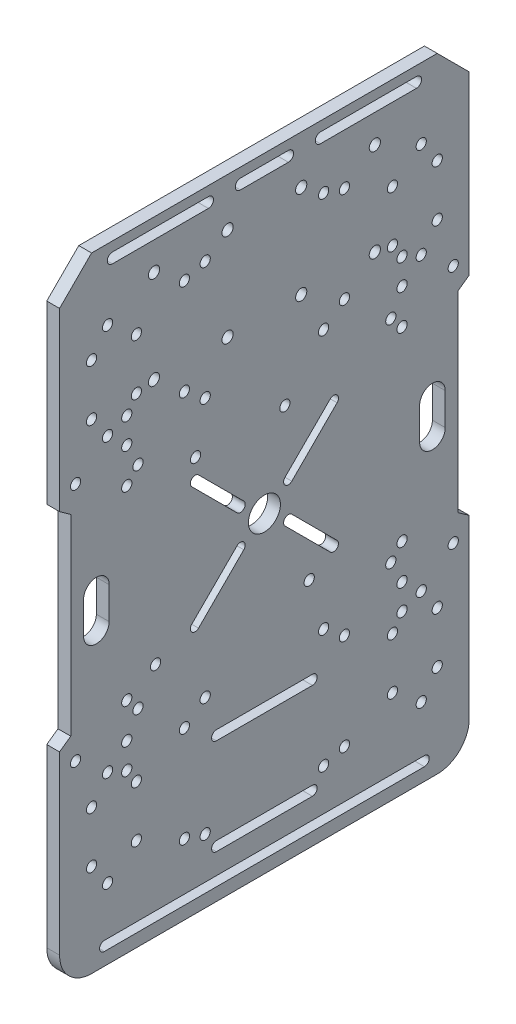
from build123d import *

# Parameters (mm, degrees)
SKETCH_2_W          = 128
SKETCH_2_H          = 195
EXTRUDE_1_DEPTH     = 4
SKETCH_3_R          = 1.6
CUT_EXTRUDE_1_DEPTH = 4
SKETCH_4_R          = 1.6
CUT_EXTRUDE_2_DEPTH = 4
SKETCH_6_R          = 1.75
SKETCH_6_R_2        = 5
SKETCH_6_R_3        = 1.6
CUT_EXTRUDE_4_DEPTH = 10
SKETCH_7_R          = 1.6
CUT_EXTRUDE_5_DEPTH = 10
CHAMFER_1_SIZE      = 10
FILLET_1_R          = 10
CUT_EXTRUDE_6_DEPTH = 10


with BuildPart() as part:
    # 草图2 → 凸台-拉伸1 (new body)
    with BuildSketch(Plane(origin=(0, 0, 0), x_dir=(0, 0, -1), z_dir=(1, 0, 0))):
        with Locations((64, 97.5)):
            Rectangle(SKETCH_2_W, SKETCH_2_H)
    extrude(amount=EXTRUDE_1_DEPTH)

    # 草图3 → 切除-拉伸1 (cut)
    with BuildSketch(Plane(origin=(4, 0, 0), x_dir=(0, 0, -1), z_dir=(1, 0, 0))):
        with Locations((24, 166)):
            Circle(SKETCH_3_R)
        with Locations((24, 150)):
            Circle(SKETCH_3_R)
        with Locations((10, 166)):
            Circle(SKETCH_3_R)
        with Locations((10, 150)):
            Circle(SKETCH_3_R)
        with Locations((24, 45)):
            Circle(SKETCH_3_R)
        with Locations((24, 29)):
            Circle(SKETCH_3_R)
        with Locations((10, 45)):
            Circle(SKETCH_3_R)
        with Locations((10, 29)):
            Circle(SKETCH_3_R)
        with Locations(Location((118, 29, 0), (0, 0, 180))):
            Circle(SKETCH_3_R)
        with Locations(Location((118, 45, 0), (0, 0, 180))):
            Circle(SKETCH_3_R)
        with Locations(Location((104, 45, 0), (0, 0, 180))):
            Circle(SKETCH_3_R)
        with Locations(Location((104, 29, 0), (0, 0, 180))):
            Circle(SKETCH_3_R)
        with Locations(Location((104, 150, 0), (0, 0, 180))):
            Circle(SKETCH_3_R)
        with Locations(Location((118, 150, 0), (0, 0, 180))):
            Circle(SKETCH_3_R)
        with Locations(Location((118, 166, 0), (0, 0, 180))):
            Circle(SKETCH_3_R)
        with Locations(Location((104, 166, 0), (0, 0, 180))):
            Circle(SKETCH_3_R)
        with Locations((15, 173)):
            Circle(SKETCH_3_R)
        with Locations((39, 173)):
            Circle(SKETCH_3_R)
        with Locations((39, 143)):
            Circle(SKETCH_3_R)
        with Locations((15, 143)):
            Circle(SKETCH_3_R)
        with Locations(Location((89, 143, 0), (0, 0, 180))):
            Circle(SKETCH_3_R)
        with Locations(Location((113, 143, 0), (0, 0, 180))):
            Circle(SKETCH_3_R)
        with Locations(Location((113, 173, 0), (0, 0, 180))):
            Circle(SKETCH_3_R)
        with Locations(Location((89, 173, 0), (0, 0, 180))):
            Circle(SKETCH_3_R)
        with Locations((113, 52)):
            Circle(SKETCH_3_R)
        with Locations((89, 52)):
            Circle(SKETCH_3_R)
        with Locations((89, 22)):
            Circle(SKETCH_3_R)
        with Locations((113, 22)):
            Circle(SKETCH_3_R)
        with Locations(Location((39, 52, 0), (0, 0, 180))):
            Circle(SKETCH_3_R)
        with Locations(Location((15, 52, 0), (0, 0, 180))):
            Circle(SKETCH_3_R)
        with Locations(Location((39, 22, 0), (0, 0, 180))):
            Circle(SKETCH_3_R)
        with Locations(Location((15, 22, 0), (0, 0, 180))):
            Circle(SKETCH_3_R)
    extrude(amount=-CUT_EXTRUDE_1_DEPTH, mode=Mode.SUBTRACT)

    # 草图4 → 切除-拉伸2 (cut)
    with BuildSketch(Plane(origin=(4, 0, 0), x_dir=(0, 0, -1), z_dir=(1, 0, 0))):
        with Locations((21, 57.5)):
            Circle(SKETCH_4_R)
        with Locations((21, 49.5)):
            Circle(SKETCH_4_R)
        with Locations(Location((107, 49.5, 0), (0, 0, 180))):
            Circle(SKETCH_4_R)
        with Locations(Location((107, 57.5, 0), (0, 0, 180))):
            Circle(SKETCH_4_R)
        with Locations((21, 145.5)):
            Circle(SKETCH_4_R)
        with Locations((21, 137.5)):
            Circle(SKETCH_4_R)
        with Locations(Location((107, 137.5, 0), (0, 0, 180))):
            Circle(SKETCH_4_R)
        with Locations(Location((107, 145.5, 0), (0, 0, 180))):
            Circle(SKETCH_4_R)
    extrude(amount=-CUT_EXTRUDE_2_DEPTH, mode=Mode.SUBTRACT)

    # 草图6 → 切除-拉伸4 (cut)
    with BuildSketch(Plane(origin=(4, 0, 0), x_dir=(0, 0, -1), z_dir=(1, 0, 0))):
        with Locations((52.5, 180)):
            Circle(SKETCH_6_R)
        with Locations((52.5, 151)):
            Circle(SKETCH_6_R)
        with Locations((29.5, 151)):
            Circle(SKETCH_6_R)
        with Locations((29.5, 180)):
            Circle(SKETCH_6_R)
        with Locations((98.5, 180)):
            Circle(SKETCH_6_R)
        with Locations((98.5, 151)):
            Circle(SKETCH_6_R)
        with Locations((75.5, 151)):
            Circle(SKETCH_6_R)
        with Locations((75.5, 180)):
            Circle(SKETCH_6_R)
        with Locations((64, 97.5)):
            Circle(SKETCH_6_R_2)
        with Locations((45.5, 175)):
            Circle(SKETCH_6_R_3)
        with Locations((82.5, 175)):
            Circle(SKETCH_6_R_3)
        with Locations((82.5, 138)):
            Circle(SKETCH_6_R_3)
        with Locations((45.5, 138)):
            Circle(SKETCH_6_R_3)
        with Locations((82.5, 20)):
            Circle(SKETCH_6_R_3)
        with Locations((45.5, 20)):
            Circle(SKETCH_6_R_3)
        with Locations((45.5, 57)):
            Circle(SKETCH_6_R_3)
        with Locations((82.5, 57)):
            Circle(SKETCH_6_R_3)
        with Locations((78, 72.5)):
            Circle(SKETCH_6_R_3)
        with Locations((42.5, 123.5)):
            Circle(SKETCH_6_R_3)
        with Locations((30, 73.7)):
            Circle(SKETCH_6_R_3)
        with Locations((70.4, 123.5)):
            Circle(SKETCH_6_R_3)
        with Locations((21, 126.5)):
            Circle(SKETCH_6_R_3)
        with Locations((107, 126.5)):
            Circle(SKETCH_6_R_3)
        with Locations((107, 68.5)):
            Circle(SKETCH_6_R_3)
        with Locations((21, 68.5)):
            Circle(SKETCH_6_R_3)
        with Locations((24.5, 64.5)):
            Circle(SKETCH_6_R_3)
        with Locations((103.5, 64.5)):
            Circle(SKETCH_6_R_3)
        with Locations((103.5, 130.5)):
            Circle(SKETCH_6_R_3)
        with Locations((24.5, 130.5)):
            Circle(SKETCH_6_R_3)
        with BuildLine():
            Line((79, 13.5), (49, 13.5))
            ThreePointArc((49, 13.5), (47.5, 15), (49, 16.5))
            Line((49, 16.5), (79, 16.5))
            ThreePointArc((79, 16.5), (80.5, 15), (79, 13.5))
        make_face()
        with BuildLine():
            Line((79, 43.5), (49, 43.5))
            ThreePointArc((49, 43.5), (47.5, 45), (49, 46.5))
            Line((49, 46.5), (79, 46.5))
            ThreePointArc((79, 46.5), (80.5, 45), (79, 43.5))
        make_face()
        with BuildLine():
            Line((16.5, 192), (46.5, 192))
            ThreePointArc((46.5, 192), (48.1, 190.4), (46.5, 188.8))
            Line((46.5, 188.8), (16.5, 188.8))
            ThreePointArc((16.5, 188.8), (14.9, 190.4), (16.5, 192))
        make_face()
        with BuildLine():
            Line((84.581475448, 76.766874121), (70.439339824, 90.909009744))
            ThreePointArc((70.439339824, 90.909009744), (70.439339828, 93.030330084), (72.560660168, 93.030330088))
            Line((72.560660168, 93.030330088), (86.702795791, 78.888194464))
            ThreePointArc((86.702795791, 78.888194464), (86.702795791, 76.766874121), (84.581475448, 76.766874121))
        make_face()
        with BuildLine():
            Line((43.418524552, 76.766874121), (57.560660176, 90.909009744))
            ThreePointArc((57.560660176, 90.909009744), (57.560660172, 93.030330084), (55.439339832, 93.030330088))
            Line((55.439339832, 93.030330088), (41.297204209, 78.888194464))
            ThreePointArc((41.297204209, 78.888194464), (41.297204209, 76.766874121), (43.418524552, 76.766874121))
        make_face()
        with BuildLine():
            Line((43.418524552, 118.233125879), (57.560660176, 104.090990256))
            ThreePointArc((57.560660176, 104.090990256), (57.560660172, 101.969669916), (55.439339832, 101.969669912))
            Line((55.439339832, 101.969669912), (41.297204209, 116.111805536))
            ThreePointArc((41.297204209, 116.111805536), (41.297204209, 118.233125879), (43.418524552, 118.233125879))
        make_face()
        with BuildLine():
            Line((84.581475448, 118.233125879), (70.439339824, 104.090990256))
            ThreePointArc((70.439339824, 104.090990256), (70.439339828, 101.969669916), (72.560660168, 101.969669912))
            Line((72.560660168, 101.969669912), (86.702795791, 116.111805536))
            ThreePointArc((86.702795791, 116.111805536), (86.702795791, 118.233125879), (84.581475448, 118.233125879))
        make_face()
        with BuildLine():
            Line((15.5, 102.5), (15.5, 92.5))
            ThreePointArc((15.5, 92.5), (11.5, 88.5), (7.5, 92.5))
            Line((7.5, 92.5), (7.5, 102.5))
            ThreePointArc((7.5, 102.5), (11.5, 106.5), (15.5, 102.5))
        make_face()
        with BuildLine():
            Line((112.5, 102.5), (112.5, 92.5))
            ThreePointArc((112.5, 92.5), (116.5, 88.5), (120.5, 92.5))
            Line((120.5, 92.5), (120.5, 102.5))
            ThreePointArc((120.5, 102.5), (116.5, 106.5), (112.5, 102.5))
        make_face()
        with BuildLine():
            Line((56.5, 192), (71.5, 192))
            ThreePointArc((71.5, 192), (73.1, 190.4), (71.5, 188.8))
            Line((71.5, 188.8), (56.5, 188.8))
            ThreePointArc((56.5, 188.8), (54.9, 190.4), (56.5, 192))
        make_face()
        with BuildLine():
            Line((111.5, 192), (81.5, 192))
            ThreePointArc((81.5, 192), (79.9, 190.4), (81.5, 188.8))
            Line((81.5, 188.8), (111.5, 188.8))
            ThreePointArc((111.5, 188.8), (113.1, 190.4), (111.5, 192))
        make_face()
        with BuildLine():
            Line((14, 7), (114, 7))
            ThreePointArc((114, 7), (115.5, 5.5), (114, 4))
            Line((114, 4), (14, 4))
            ThreePointArc((14, 4), (12.5, 5.5), (14, 7))
        make_face()
    extrude(amount=-CUT_EXTRUDE_4_DEPTH, mode=Mode.SUBTRACT)

    # 草图7 → 切除-拉伸5 (cut)
    with BuildSketch(Plane(origin=(4, 0, 0), x_dir=(0, 0, -1), z_dir=(1, 0, 0))):
        with Locations((123, 135)):
            Circle(SKETCH_7_R)
        with Locations((123, 60)):
            Circle(SKETCH_7_R)
        with Locations((5, 60)):
            Circle(SKETCH_7_R)
        with Locations((5, 135)):
            Circle(SKETCH_7_R)
    extrude(amount=-CUT_EXTRUDE_5_DEPTH, mode=Mode.SUBTRACT)

    # 倒角1
    chamfer_1_edges = [part.edges().sort_by_distance(p)[0] for p in [
        (2, 195, 0),
        (2, 195, -128),
    ]]
    chamfer(chamfer_1_edges, length=CHAMFER_1_SIZE)

    # 圆角1
    fillet_1_edges = [part.edges().sort_by_distance(p)[0] for p in [
        (2, 0, -128),
        (2, 0, 0),
    ]]
    fillet(fillet_1_edges, radius=FILLET_1_R)

    # 草图8 → 切除-拉伸6 (cut)
    with BuildSketch(Plane(origin=(4, 0, 0), x_dir=(0, 0, -1), z_dir=(1, 0, 0))):
        Polygon((128, 130), (128, 65), (124.5, 67.5), (124.5, 127.5), align=None)
        Polygon((0, 65), (3.5, 67.5), (3.5, 127.5), (0, 130), align=None)
    extrude(amount=-CUT_EXTRUDE_6_DEPTH, mode=Mode.SUBTRACT)


solid = part.part
